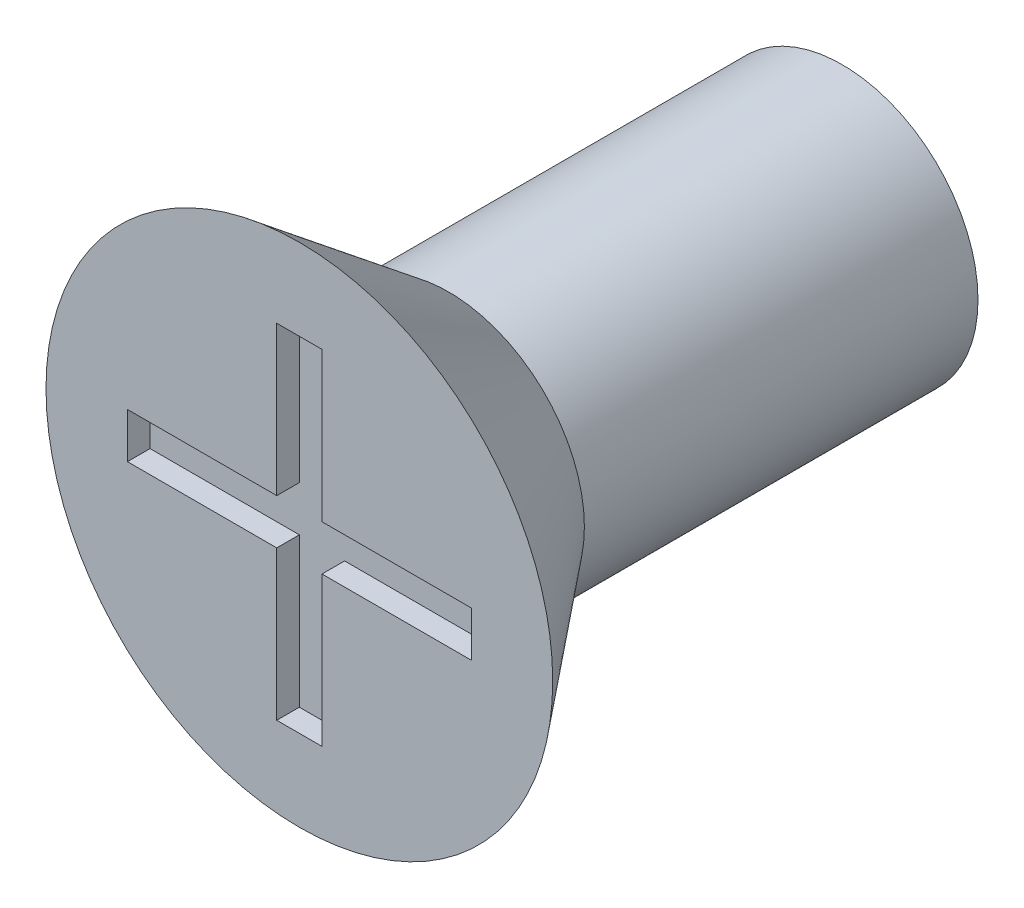
from build123d import *

# Parameters (mm, degrees)
SKETCH5_W          = 3.8
SKETCH5_H          = 0.5
SKETCH5_W_2        = 0.5
SKETCH5_H_2        = 3.8
CUT_EXTRUDE2_DEPTH = 0.25


with BuildPart() as part:
    # Sketch4 → Revolve1 (revolve)
    with BuildSketch(Plane(origin=(0, 0, 0), x_dir=(0, 0, -1), z_dir=(1, 0, 0)), mode=Mode.PRIVATE) as revolve1_sk:
        Polygon((0, 0), (0, 2.8), (1.65, 1.5), (6, 1.5), (6, 0), align=None)
    revolve(revolve1_sk.sketch.rotate(Axis((0, 0, 0), (0, 0, -1)), 90), axis=Axis((0, 0, 0), (0, 0, -1)))

    # Sketch5 → Cut-Extrude2 (cut)
    with BuildSketch(Plane.XY):
        Rectangle(SKETCH5_W, SKETCH5_H)
        Rectangle(SKETCH5_W_2, SKETCH5_H_2)
    extrude(amount=-CUT_EXTRUDE2_DEPTH, mode=Mode.SUBTRACT)


solid = part.part
